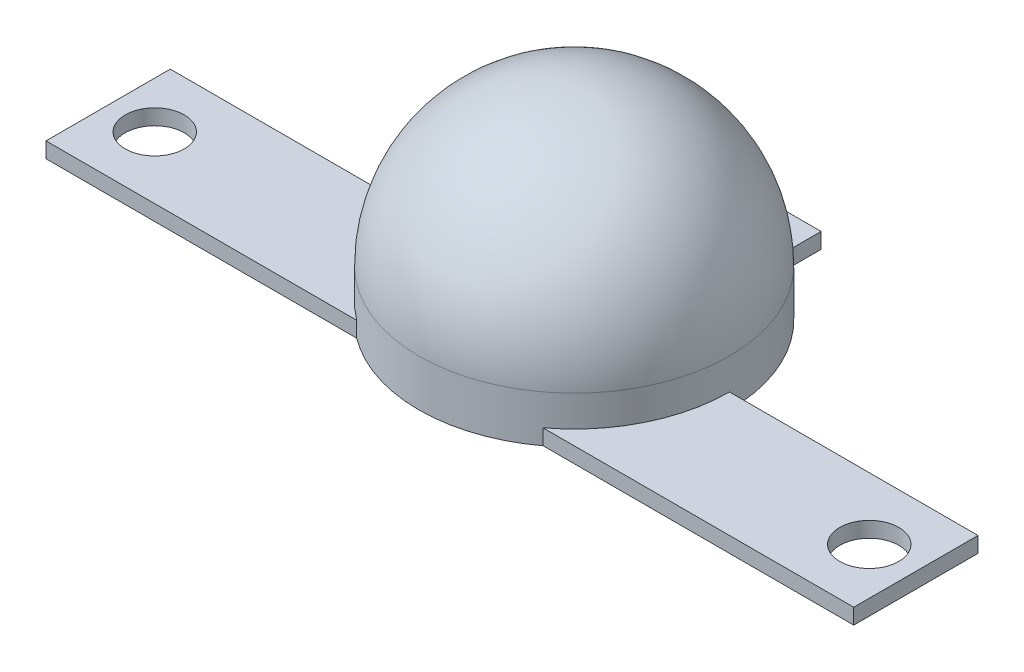
from build123d import *

# Parameters (mm, degrees)
SKETCH_2_R      = 1.9
EXTRUDE_1_DEPTH = 1


with BuildPart() as part:
    # Эскиз1 → Повернуть1 (revolve)
    with BuildSketch(Plane.XY, mode=Mode.PRIVATE) as revolve_1_sk:
        with BuildLine():
            Line((8.8, 0), (10, 0))
            Line((10, 0), (10, 3))
            ThreePointArc((10, 3), (7.071067812, 10.071067812), (0, 13))
            Line((0, 13), (0, 11.8))
            ThreePointArc((0, 11.8), (6.222539674, 9.222539674), (8.8, 3))
            Line((8.8, 3), (8.8, 0))
        make_face()
    revolve(revolve_1_sk.sketch.rotate(Axis((0, 13, 0), (0, -1, 0)), 90), axis=Axis((0, 13, 0), (0, -1, 0)))

    # Эскиз2 → Бобышка-Вытянуть1 (add)
    # profile 1 of 3: a face of its own
    with BuildSketch(Plane(origin=(0, 0, 0), x_dir=(1, 0, 0), z_dir=(0, 1, 0))):
        Polygon((0, -8), (0, 0), (-4, 0), (-26, 0), (-26, -8), align=None)
        with Locations(Location((-23, -4, 0), (0, 0, 270))):
            Circle(SKETCH_2_R, mode=Mode.SUBTRACT)
    # profile 2 of 3: a face of its own
    with BuildSketch(Plane(origin=(0, 0, 0), x_dir=(1, 0, 0), z_dir=(0, 1, 0))):
        Polygon((26, -8), (26, 0), (4, 0), (0, 0), (0, -8), align=None)
        with Locations(Location((23, -4, 0), (0, 0, 270))):
            Circle(SKETCH_2_R, mode=Mode.SUBTRACT)
    # profile 3 of 3: a face of its own
    with BuildSketch(Plane(origin=(0, 0, 0), x_dir=(1, 0, 0), z_dir=(0, 1, 0))):
        Polygon((0, 0), (4, 0), (4, 11.9), (-4, 11.9), (-4, 0), align=None)
    extrude(amount=EXTRUDE_1_DEPTH)


solid = part.part
